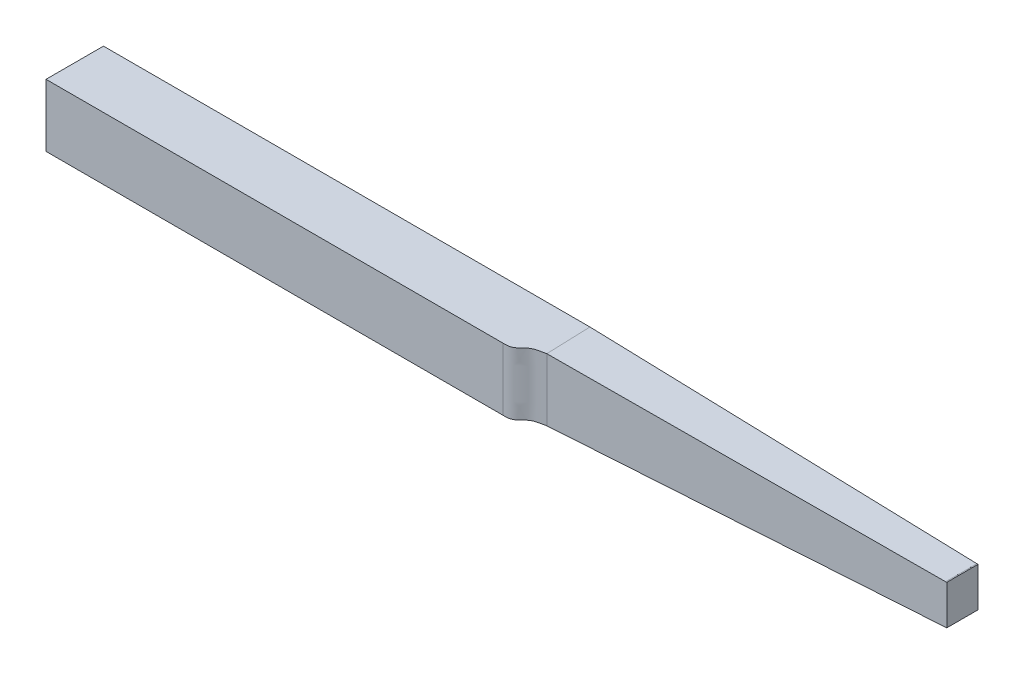
from build123d import *

# Parameters (mm, degrees)
CROQUIS1_W                 = 1120
CROQUIS1_H                 = 73.6
SALIENTE_EXTRUIR2_DEPTH    = 80
CORTAR_EXTRUIR1_DEPTH      = 567.881151565
CORTAR_EXTRUIR1_DEPTH_BACK = 80
CORTAR_EXTRUIR2_DEPTH      = 80
CORTAR_EXTRUIR6_DEPTH      = 80
CROQUIS9_W                 = 1.38989899
CROQUIS9_H                 = 14.75
CORTAR_EXTRUIR7_DEPTH      = 80
CORTAR_EXTRUIR11_DEPTH     = 80
CROQUIS11_W                = 1.38989899
CROQUIS11_H                = 14.75
CORTAR_EXTRUIR12_DEPTH     = 80


with BuildPart() as part:
    # Croquis1 → Saliente-Extruir2 (new body)
    with BuildSketch(Plane(origin=(0, 0, 0), x_dir=(-1, 0, 0), z_dir=(0, 1, 0))):
        Rectangle(CROQUIS1_W, CROQUIS1_H)
    extrude(amount=SALIENTE_EXTRUIR2_DEPTH)

    # Croquis3 → Cortar-Extruir1 (cut, two sides: drawn at the far end of the back side and taken through both)
    with BuildSketch(Plane(origin=(0, 80, 0), x_dir=(-1, 0, 0), z_dir=(0, 1, 0)).offset(-CORTAR_EXTRUIR1_DEPTH_BACK)):
        Polygon((-2813.471365519, -75.102439368), (-560, 3.2), (-65, 20.4), (-65, 36.8), (-560, 36.8), (-2814.831361149, 36.8), (-7324.161069919, -18.003708809), (-7322.801074288, -129.906148176), align=None)
    extrude(amount=CORTAR_EXTRUIR1_DEPTH + CORTAR_EXTRUIR1_DEPTH_BACK, mode=Mode.SUBTRACT)

    # Croquis5 → Cortar-Extruir2 (cut)
    with BuildSketch(Plane(origin=(0, 80, 0), x_dir=(-1, 0, 0), z_dir=(0, 1, 0))):
        with BuildLine():
            Line((-65, 20.4), (-65, 36.8))
            Line((-65, 36.8), (-25, 36.8))
            add(Edge.make_bspline(
                [(-65, 20.4), (-56.784244263, 22.107577244), (-47.818766965, 23.337438109), (-39.843013972, 33.586115732), (-32.987752431, 36.631059032), (-31.175714622, 36.8), (-25, 36.8)],
                knots=[0, 0, 0, 0, 0.422650191, 0.727847648, 0.789397597, 1, 1, 1, 1], degree=3))
        make_face()
    extrude(amount=-CORTAR_EXTRUIR2_DEPTH, mode=Mode.SUBTRACT)

    # Croquis6 → Cortar-Extruir6 (cut)
    with BuildSketch(Plane(origin=(0.786379176, 0, 22.631261168), x_dir=(0.9993968526186474, 0, -0.0347265168990722), z_dir=(0.0347265168990722, 0, 0.9993968526186474))):
        Polygon((64.252374475, 0), (559.551112612, 0), (559.551112612, 14.75), align=None)
    extrude(amount=-CORTAR_EXTRUIR6_DEPTH, mode=Mode.SUBTRACT)

    # Croquis9 → Cortar-Extruir7 (cut)
    with BuildSketch(Plane(origin=(0, 0, -36.8), x_dir=(1, 0, 0), z_dir=(0, 0, -1))):
        with Locations((559.305050505, -7.375)):
            Rectangle(CROQUIS9_W, CROQUIS9_H)
    extrude(amount=-CORTAR_EXTRUIR7_DEPTH, mode=Mode.SUBTRACT)

    # Croquis10 → Cortar-Extruir11 (cut)
    with BuildSketch(Plane(origin=(0.786379176, 0, 22.631261168), x_dir=(0.9993968526186474, 0, -0.0347265168990722), z_dir=(0.0347265168990722, 0, 0.9993968526186474))):
        Polygon((64.252374475, 80), (559.551112612, 65.25), (559.551112612, 80), align=None)
    extrude(amount=-CORTAR_EXTRUIR11_DEPTH, mode=Mode.SUBTRACT)

    # Croquis11 → Cortar-Extruir12 (cut)
    with BuildSketch(Plane(origin=(0, 0, -36.8), x_dir=(1, 0, 0), z_dir=(0, 0, -1))):
        with Locations((559.305050505, -72.625)):
            Rectangle(CROQUIS11_W, CROQUIS11_H)
    extrude(amount=-CORTAR_EXTRUIR12_DEPTH, mode=Mode.SUBTRACT)


solid = part.part
